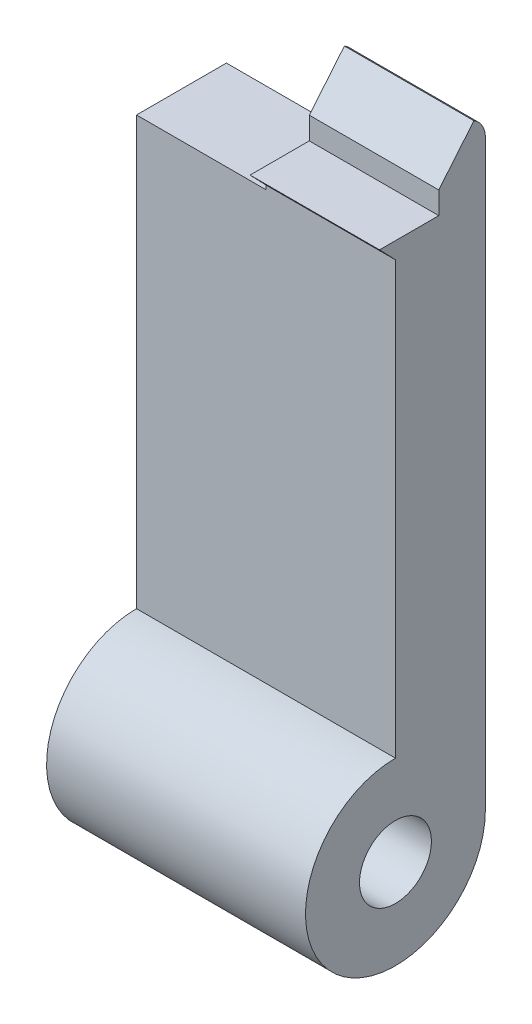
from build123d import *

# Parameters (mm, degrees)
SKETCH2_R           = 1.27
BOSS_EXTRUDE1_DEPTH = 9.144
SKETCH3_W           = 4.572
SKETCH3_H           = 3.009435793
CUT_EXTRUDE1_DEPTH  = 25.018241396


with BuildPart() as part:
    # Sketch2 → Boss-Extrude1 (new body)
    with BuildSketch(Plane(origin=(0, 0, 0), x_dir=(0, 0, -1), z_dir=(1, 0, 0))):
        with BuildLine():
            Line((0, 18.415), (0, 3.175))
            ThreePointArc((0, 3.175), (-2.24506403, -2.24506403), (3.175, 0))
            Line((3.175, 0), (3.175, 20.574))
            ThreePointArc((3.175, 20.574), (3.066754835, 20.981875221), (2.770508017, 21.282403148))
            Line((2.770508017, 21.282403148), (1.52985297, 19.787480142))
            Line((1.52985297, 19.787480142), (1.52985297, 19.000960284))
            Line((1.52985297, 19.000960284), (-0.561351088, 19.000960284))
            Line((-0.561351088, 19.000960284), (0, 18.415))
        make_face()
        Circle(SKETCH2_R, mode=Mode.SUBTRACT)
    extrude(amount=BOSS_EXTRUDE1_DEPTH)

    # Sketch3 → Cut-Extrude1 (cut, through all)
    with BuildSketch(Plane(origin=(0, 0, -3.175), x_dir=(-1, 0, 0), z_dir=(0, 0, -1))):
        with Locations((-2.286, 19.777685252)):
            Rectangle(SKETCH3_W, SKETCH3_H)
    extrude(amount=-CUT_EXTRUDE1_DEPTH, mode=Mode.SUBTRACT)


solid = part.part
